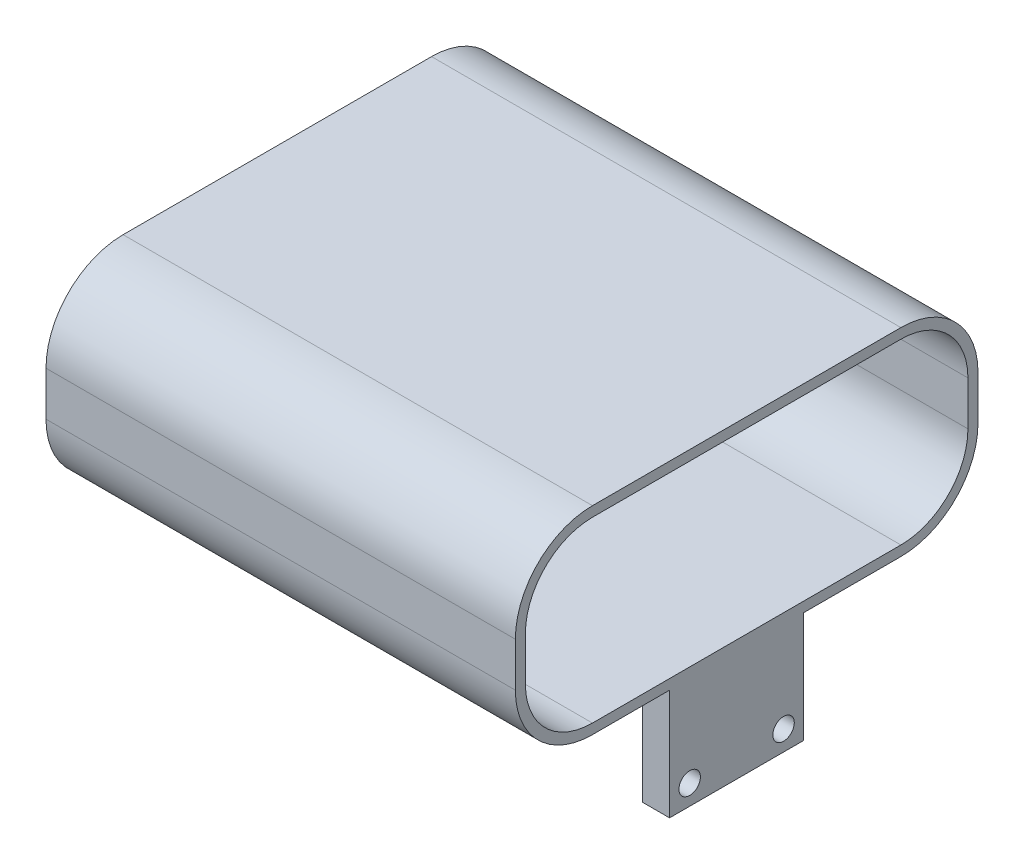
from build123d import *

# Parameters (mm, degrees)
EXTRUDE_2_DEPTH     = 70
EXTRUDE_3_DEPTH     = 2
SKETCH_7_W          = 20
SKETCH_7_H          = 18
SKETCH_7_R          = 1.6
EXTRUDE_5_DEPTH     = 4
SKETCH_8_W          = 28
SKETCH_8_H          = 11.5
CUT_EXTRUDE_2_DEPTH = 11.5


with BuildPart() as part:
    # 草图1 → 凸台-拉伸2 (new body)
    with BuildSketch(Plane.ZY.offset(35)):
        with BuildLine():
            Line((23.72736994, 25.369984756), (-22.27263006, 25.369984756))
            ThreePointArc((-22.27263006, 25.369984756), (-30.404358044, 22.001712739), (-33.77263006, 13.869984756))
            Line((-33.77263006, 13.869984756), (-33.77263006, 7.291341901))
            ThreePointArc((-33.77263006, 7.291341901), (-30.404358044, -0.840386083), (-22.27263006, -4.208658099))
            Line((-22.27263006, -4.208658099), (23.72736994, -4.208658099))
            ThreePointArc((23.72736994, -4.208658099), (31.859097923, -0.840386083), (35.22736994, 7.291341901))
            Line((35.22736994, 7.291341901), (35.22736994, 13.869984756))
            ThreePointArc((35.22736994, 13.869984756), (31.859097923, 22.001712739), (23.72736994, 25.369984756))
        make_face()
        with BuildLine():
            ThreePointArc((-32.27263006, 13.869984756), (-29.343697872, 20.941052568), (-22.27263006, 23.869984756))
            Line((-22.27263006, 23.869984756), (23.72736994, 23.869984756))
            ThreePointArc((23.72736994, 23.869984756), (30.798437752, 20.941052568), (33.72736994, 13.869984756))
            Line((33.72736994, 13.869984756), (33.72736994, 7.291341901))
            ThreePointArc((33.72736994, 7.291341901), (30.798437752, 0.220274089), (23.72736994, -2.708658099))
            Line((23.72736994, -2.708658099), (-22.27263006, -2.708658099))
            ThreePointArc((-22.27263006, -2.708658099), (-29.343697872, 0.220274089), (-32.27263006, 7.291341901))
            Line((-32.27263006, 7.291341901), (-32.27263006, 13.869984756))
        make_face(mode=Mode.SUBTRACT)
    extrude(amount=-EXTRUDE_2_DEPTH)

    # 草图1<4> → 凸台-拉伸3 (add)
    with BuildSketch(Plane.ZY.offset(35)):
        with BuildLine():
            Line((-22.27263006, 23.869984756), (23.72736994, 23.869984756))
            ThreePointArc((23.72736994, 23.869984756), (30.798437752, 20.941052568), (33.72736994, 13.869984756))
            Line((33.72736994, 13.869984756), (33.72736994, 7.291341901))
            ThreePointArc((33.72736994, 7.291341901), (30.798437752, 0.220274089), (23.72736994, -2.708658099))
            Line((23.72736994, -2.708658099), (-22.27263006, -2.708658099))
            ThreePointArc((-22.27263006, -2.708658099), (-29.343697872, 0.220274089), (-32.27263006, 7.291341901))
            Line((-32.27263006, 7.291341901), (-32.27263006, 13.869984756))
            ThreePointArc((-32.27263006, 13.869984756), (-29.343697872, 20.941052568), (-22.27263006, 23.869984756))
        make_face()
    extrude(amount=-EXTRUDE_3_DEPTH)

    # 草图7 → 凸台-拉伸5 (add)
    with BuildSketch(Plane(origin=(35, 0, 0), x_dir=(0, 0, -1), z_dir=(1, 0, 0))):
        with Locations((-2.22736994, -11.708658099)):
            Rectangle(SKETCH_7_W, SKETCH_7_H)
        with Locations((4.77263006, -17.708658099)):
            Circle(SKETCH_7_R, mode=Mode.SUBTRACT)
        with Locations((-9.22736994, -17.708658099)):
            Circle(SKETCH_7_R, mode=Mode.SUBTRACT)
    extrude(amount=-EXTRUDE_5_DEPTH)

    # 草图8 → 切除-拉伸2 (cut)
    with BuildSketch(Plane(origin=(0, 0, -33.77263006), x_dir=(-1, 0, 0), z_dir=(0, 0, -1))):
        with Locations((19, 1.541341901)):
            Rectangle(SKETCH_8_W, SKETCH_8_H)
    extrude(amount=-CUT_EXTRUDE_2_DEPTH, mode=Mode.SUBTRACT)


solid = part.part
